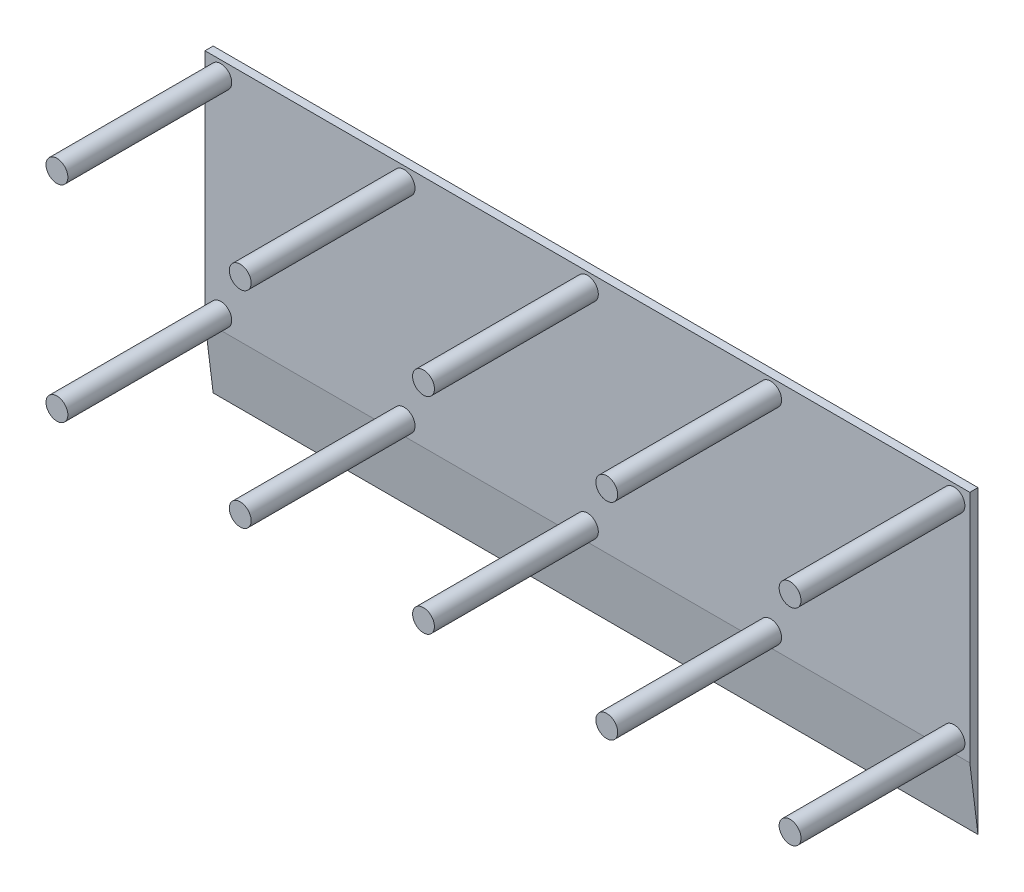
from build123d import *

# Parameters (mm, degrees)
ESBO_O1_W                = 280
ESBO_O1_H                = 110
RESSALTO_EXTRUS_O1_DEPTH = 3
CORTE_EXTRUS_O1_DEPTH    = 280
ESBO_O4_R                = 4
RESSALTO_EXTRUS_O2_DEPTH = 60


with BuildPart() as part:
    # Esboço1 → Ressalto-extrusão1 (new body)
    with BuildSketch(Plane.XY):
        Rectangle(ESBO_O1_W, ESBO_O1_H)
    extrude(amount=RESSALTO_EXTRUS_O1_DEPTH)

    # Esboço3 → Corte-extrusão1 (cut)
    with BuildSketch(Plane.ZY.offset(140)):
        Polygon((0, -55), (3.02401214, -30.57), (3, -55), align=None)
    extrude(amount=-CORTE_EXTRUS_O1_DEPTH, mode=Mode.SUBTRACT)

    # Esboço4 → Ressalto-extrusão2 (add)
    with BuildSketch(Plane.XY.offset(3)):
        with Locations(Location((134.2, 49.8, 0), (0, 0, 180))):
            Circle(ESBO_O4_R)
        with Locations(Location((67.1, 49.8, 0), (0, 0, 180))):
            Circle(ESBO_O4_R)
        with Locations(Location((0, 49.8, 0), (0, 0, 180))):
            Circle(ESBO_O4_R)
        with Locations(Location((-67.1, 49.8, 0), (0, 0, 180))):
            Circle(ESBO_O4_R)
        with Locations(Location((-134.2, 49.8, 0), (0, 0, 180))):
            Circle(ESBO_O4_R)
        with Locations(Location((-134.2, -25.563986188, 0), (0, 0, 180))):
            Circle(ESBO_O4_R)
        with Locations(Location((-67.1, -25.563986188, 0), (0, 0, 180))):
            Circle(ESBO_O4_R)
        with Locations(Location((0, -25.563986188, 0), (0, 0, 180))):
            Circle(ESBO_O4_R)
        with Locations(Location((67.1, -25.563986188, 0), (0, 0, 180))):
            Circle(ESBO_O4_R)
        with Locations(Location((134.2, -25.563986188, 0), (0, 0, 180))):
            Circle(ESBO_O4_R)
    extrude(amount=RESSALTO_EXTRUS_O2_DEPTH)


solid = part.part
